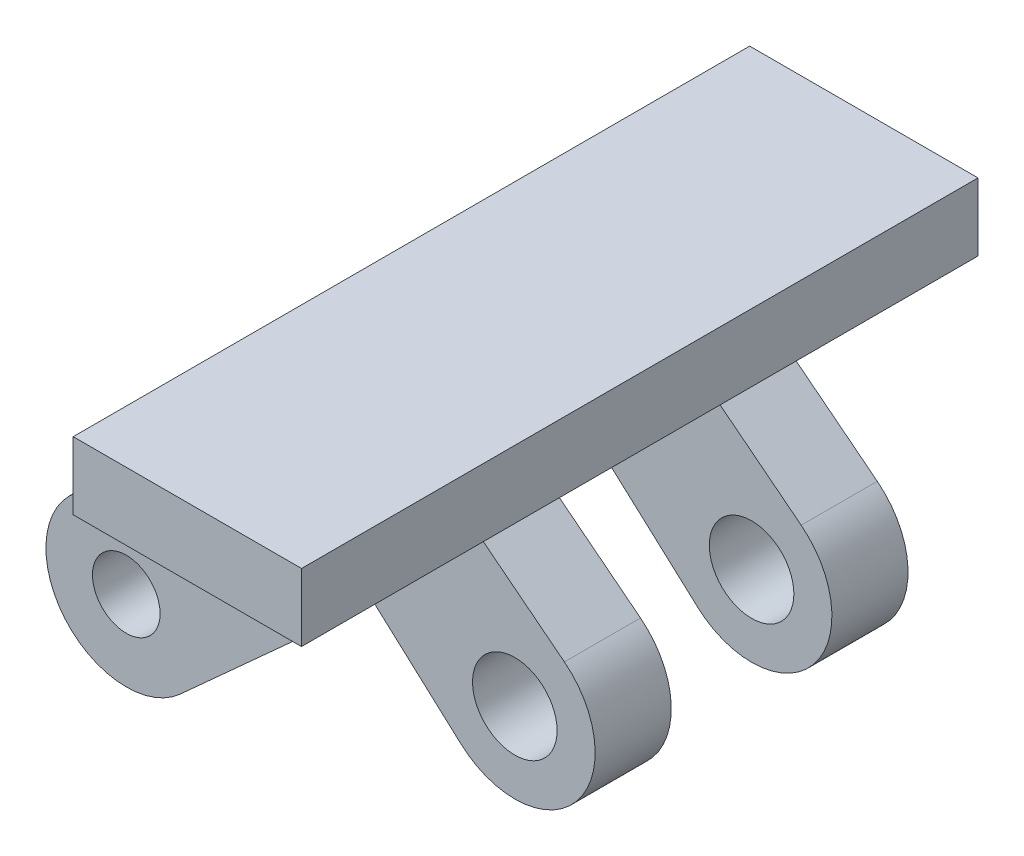
from build123d import *

# Parameters (mm, degrees)
EXTRUDE_1_DEPTH      = 8
EXTRUDE_1_DEPTH_BACK = 8
SKETCH_1_W           = 5.4
SKETCH_1_H           = 1.6
SKETCH_3_R           = 0.8
EXTRUDE_2_DEPTH      = 2
SKETCH_5_R           = 1
EXTRUDE_3_DEPTH      = 1.8


with BuildPart() as part:
    # 草图1 → 凸台-拉伸1 (new, two sides: drawn at the far end of the back side and taken through both)
    with BuildSketch(Plane.XY.offset(-EXTRUDE_1_DEPTH_BACK)):
        with Locations((2.7, -0.8)):
            Rectangle(SKETCH_1_W, SKETCH_1_H)
    extrude(amount=EXTRUDE_1_DEPTH + EXTRUDE_1_DEPTH_BACK)

    # 草图3 → 凸台-拉伸2 (add)
    with BuildSketch(Plane.XY.offset(6)):
        with BuildLine():
            Line((5.4, -1.6), (0, -1.6))
            Line((0, -1.6), (-1.918050883, -3.105359031))
            ThreePointArc((-1.918050883, -3.105359031), (-2.19749748, -5.824847366), (0.53013096, -6.008559916))
            Line((0.53013096, -6.008559916), (5.4, -1.6))
        make_face()
        with Locations((-0.745, -4.6)):
            Circle(SKETCH_3_R, mode=Mode.SUBTRACT)
    extrude_2 = extrude(amount=-EXTRUDE_2_DEPTH)

    # 草图5 → 凸台-拉伸3 (add)
    with BuildSketch(Plane.XY.offset(3.7)):
        with BuildLine():
            Line((7.318050883, -3.105359031), (5.4, -1.6))
            Line((5.4, -1.6), (0, -1.6))
            Line((0, -1.6), (4.86986904, -6.008559916))
            ThreePointArc((4.86986904, -6.008559916), (7.59749748, -5.824847366), (7.318050883, -3.105359031))
        make_face()
        with Locations((6.145, -4.6)):
            Circle(SKETCH_5_R, mode=Mode.SUBTRACT)
    extrude_3 = extrude(amount=-EXTRUDE_3_DEPTH)

    # 镜向1: 凸台-拉伸2, 凸台-拉伸3 across plane
    add(extrude_2.mirror(Plane.XY))
    add(extrude_3.mirror(Plane.XY))


solid = part.part
